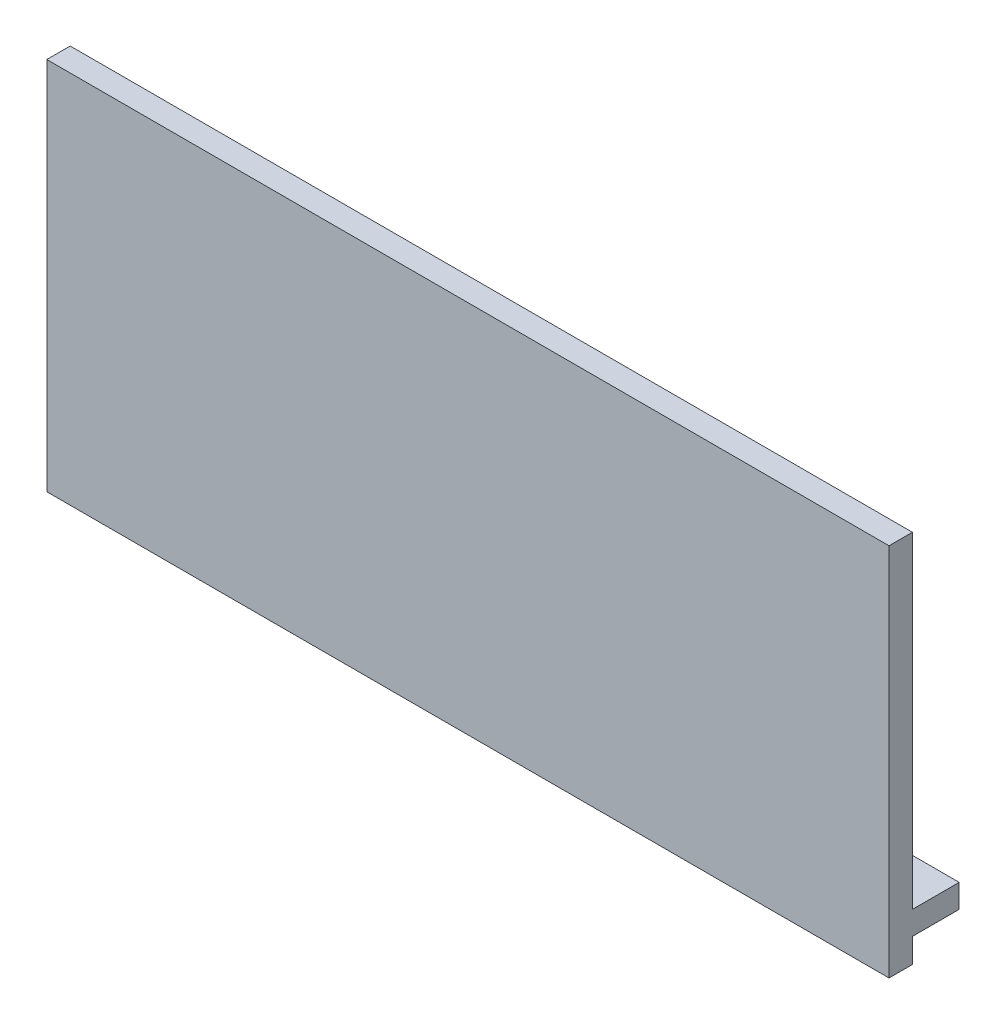
from build123d import *

# Parameters (mm, degrees)
SKETCH1_W                = 180
SKETCH1_H                = 80
BOSS_EXTRUDE1_DEPTH      = 5
BOSS_EXTRUDE2_DEPTH      = 1
BOSS_EXTRUDE2_DEPTH_BACK = 10
SKETCH1_4_W              = 180
SKETCH1_4_H              = 5
CUT_EXTRUDE3_REACH       = 195.318
SKETCH2_R                = 1.4


with BuildPart() as part:
    # Sketch1 → Boss-Extrude1 (new body)
    with BuildSketch(Plane.XY):
        with Locations((90, 40)):
            Rectangle(SKETCH1_W, SKETCH1_H)
    extrude(amount=BOSS_EXTRUDE1_DEPTH)

    # Sketch1<4> → Boss-Extrude2 (add, two sides: drawn at the far end of the back side and taken through both)
    with BuildSketch(Plane.XY.offset(-BOSS_EXTRUDE2_DEPTH_BACK)):
        with Locations((90, 7.7)):
            Rectangle(SKETCH1_4_W, SKETCH1_4_H)
    extrude(amount=BOSS_EXTRUDE2_DEPTH + BOSS_EXTRUDE2_DEPTH_BACK)

    # Sketch2 → Cut-Extrude3 (cut, up to next)
    with BuildSketch(Plane(origin=(0, 10.2, 0), x_dir=(1, 0, 0), z_dir=(0, 1, 0)), mode=Mode.PRIVATE) as cut_extrude3_sk1:
        with Locations((15, 5)):
            Circle(SKETCH2_R)
    cut_extrude3_tool1 = extrude(cut_extrude3_sk1.sketch, amount=-CUT_EXTRUDE3_REACH, mode=Mode.PRIVATE) & part.part
    # Sketch2 → Cut-Extrude3 (cut, up to next)
    with BuildSketch(Plane(origin=(0, 10.2, 0), x_dir=(1, 0, 0), z_dir=(0, 1, 0)), mode=Mode.PRIVATE) as cut_extrude3_sk2:
        with Locations((90, 5)):
            Circle(SKETCH2_R)
    cut_extrude3_tool2 = extrude(cut_extrude3_sk2.sketch, amount=-CUT_EXTRUDE3_REACH, mode=Mode.PRIVATE) & part.part
    # Sketch2 → Cut-Extrude3 (cut, up to next)
    with BuildSketch(Plane(origin=(0, 10.2, 0), x_dir=(1, 0, 0), z_dir=(0, 1, 0)), mode=Mode.PRIVATE) as cut_extrude3_sk3:
        with Locations((165, 5)):
            Circle(SKETCH2_R)
    cut_extrude3_tool3 = extrude(cut_extrude3_sk3.sketch, amount=-CUT_EXTRUDE3_REACH, mode=Mode.PRIVATE) & part.part
    add(cut_extrude3_tool1.solids().sort_by_distance((15, 10.2, -5))[0], mode=Mode.SUBTRACT)
    add(cut_extrude3_tool2.solids().sort_by_distance((90, 10.2, -5))[0], mode=Mode.SUBTRACT)
    add(cut_extrude3_tool3.solids().sort_by_distance((165, 10.2, -5))[0], mode=Mode.SUBTRACT)


solid = part.part
